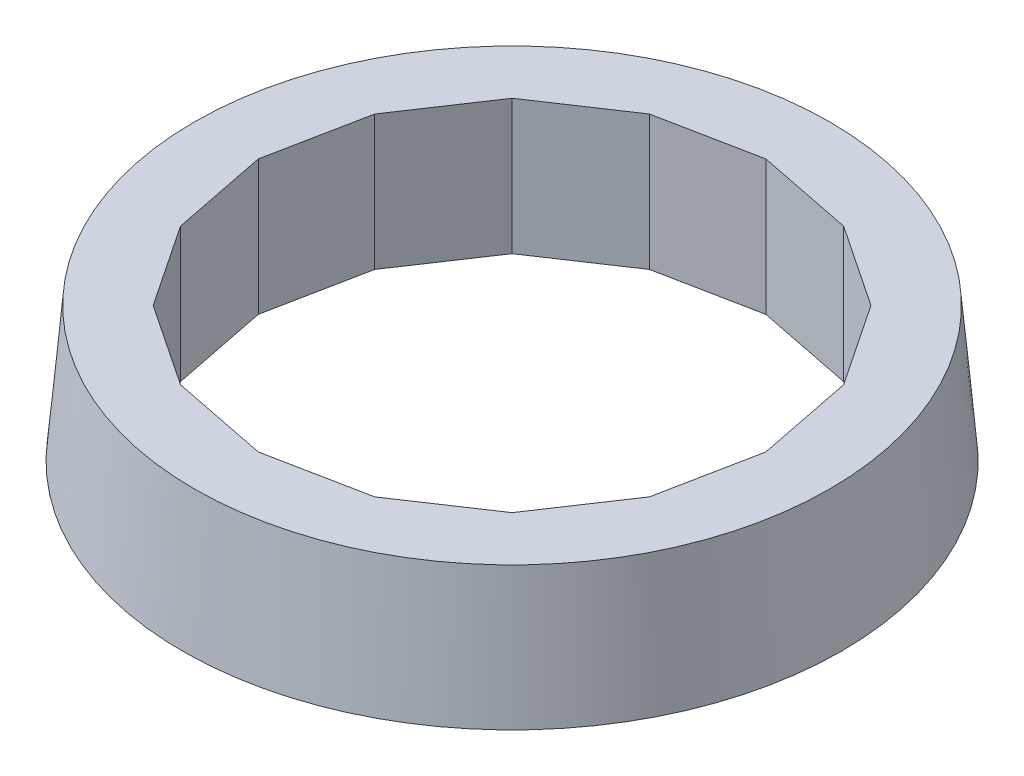
from build123d import *

# Parameters (mm, degrees)
BOSS_EXTRUDE1_DEPTH = 19.05


with BuildPart() as part:
    # Sketch1 → Boss-Extrude1 (new body)
    with BuildSketch(Plane(origin=(0, 0, 0), x_dir=(1, 0, 0), z_dir=(0, 1, 0))):
        Polygon((-55.333344517, 0), (-51.121344464, -21.175154204), (-39.126583134, -39.126583134), (-21.175154204, -51.121344464), (0, -55.333344517), (21.175154204, -51.121344464), (39.126583134, -39.126583134), (51.121344464, -21.175154204), (55.333344517, 0), (51.121344464, 21.175154204), (39.126583134, 39.126583134), (21.175154204, 51.121344464), (0, 55.333344517), (-21.175154204, 51.121344464), (-39.126583134, 39.126583134), (-51.121344464, 21.175154204), align=None)
        Polygon((-35.910132953, 0), (-33.176636845, -13.742212935), (-25.392298524, -25.392298524), (-13.742212935, -33.176636845), (0, -35.910132953), (13.742212935, -33.176636845), (25.392298524, -25.392298524), (33.176636845, -13.742212935), (35.910132953, 0), (33.176636845, 13.742212935), (25.392298524, 25.392298524), (13.742212935, 33.176636845), (0, 35.910132953), (-13.742212935, 33.176636845), (-25.392298524, 25.392298524), (-33.176636845, 13.742212935), align=None, mode=Mode.SUBTRACT)
    extrude(amount=BOSS_EXTRUDE1_DEPTH)

    # Sketch3 → Cut-Revolve1 (revolve, cut)
    with BuildSketch(Plane.XY, mode=Mode.PRIVATE) as cut_revolve1_sk:
        Polygon((-46.636756029, 0), (-44.45, 24.994735789), (-114.963192857, 24.994735789), (-114.963192857, 0), align=None)
    revolve(cut_revolve1_sk.sketch.rotate(Axis((0, 0, 0), (0, 1, 0)), 180), axis=Axis((0, 0, 0), (0, 1, 0)), mode=Mode.SUBTRACT)


solid = part.part
